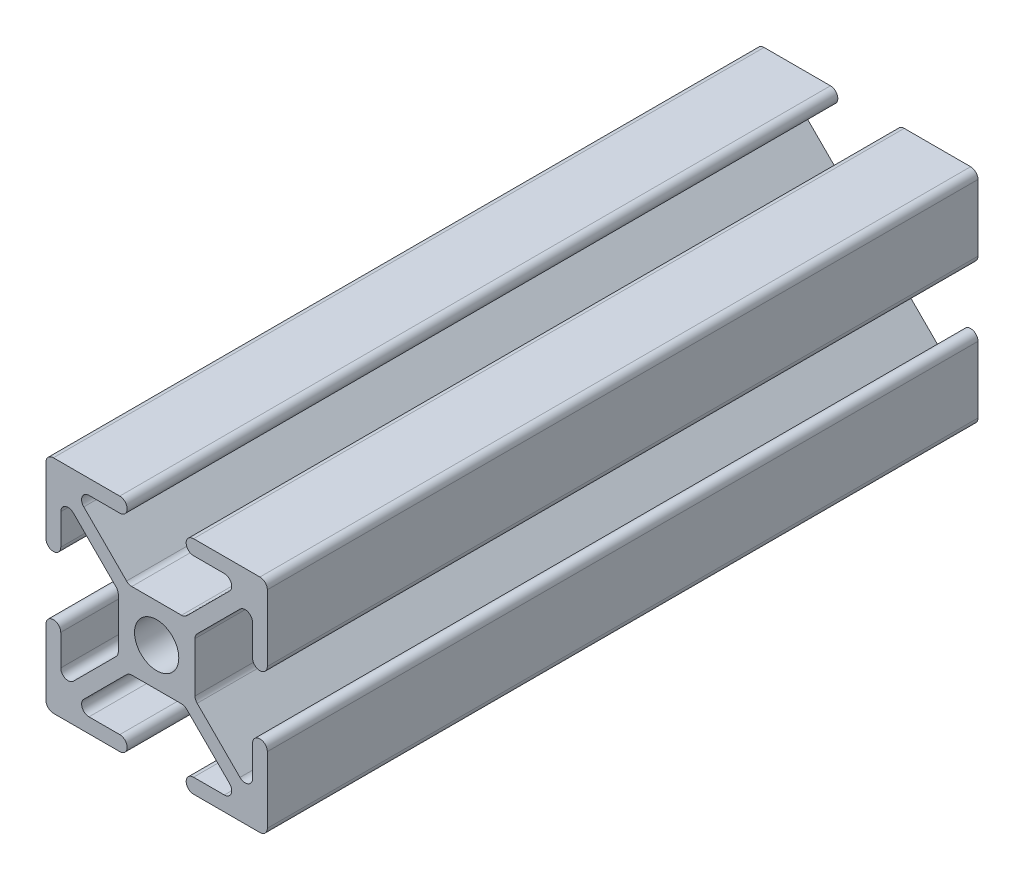
from build123d import *

# Parameters (mm, degrees)
SALIENTE_EXTRUIR1_DEPTH = 96.34
CROQUIS2_R              = 3
CORTAR_EXTRUIR1_DEPTH   = 99.647836266
CORTAR_EXTRUIR3_DEPTH   = 99.647836266


with BuildPart() as part:
    # Croquis1 → Saliente-Extruir1 (new body)
    with BuildSketch(Plane.XY):
        with BuildLine():
            Line((-14, 15), (14, 15))
            ThreePointArc((14, 15), (14.707106781, 14.707106781), (15, 14))
            Line((15, 14), (15, -14))
            ThreePointArc((15, -14), (14.707106781, -14.707106781), (14, -15))
            Line((14, -15), (-14, -15))
            ThreePointArc((-14, -15), (-14.707106781, -14.707106781), (-15, -14))
            Line((-15, -14), (-15, 14))
            ThreePointArc((-15, 14), (-14.707106781, 14.707106781), (-14, 15))
        make_face()
    extrude(amount=-SALIENTE_EXTRUIR1_DEPTH)

    # Croquis2 → Cortar-Extruir1 (cut, through all)
    with BuildSketch(Plane.XY):
        Circle(CROQUIS2_R)
    extrude(amount=-CORTAR_EXTRUIR1_DEPTH, mode=Mode.SUBTRACT)

    # Croquis3 → Cortar-Extruir3 (cut, through all)
    with BuildSketch(Plane.XY):
        with BuildLine():
            Line((-5.492893219, 4.078679656), (-11.292893219, 9.878679656))
            ThreePointArc((-11.292893219, 9.878679656), (-12.382683432, 10.095452408), (-13, 9.171572875))
            Line((-13, 9.171572875), (-13, 5))
            ThreePointArc((-13, 5), (-14, 4), (-15, 5))
            Line((-15, 5), (-15, -5))
            ThreePointArc((-15, -5), (-14, -4), (-13, -5))
            Line((-13, -5), (-13, -9.171572875))
            ThreePointArc((-13, -9.171572875), (-12.382683432, -10.095452408), (-11.292893219, -9.878679656))
            Line((-11.292893219, -9.878679656), (-5.492893219, -4.078679656))
            ThreePointArc((-5.492893219, -4.078679656), (-5.276120467, -3.754256308), (-5.2, -3.371572875))
            Line((-5.2, -3.371572875), (-5.2, 3.371572875))
            ThreePointArc((-5.2, 3.371572875), (-5.276120467, 3.754256308), (-5.492893219, 4.078679656))
        make_face()
        with BuildLine():
            ThreePointArc((-9.171572875, 13), (-10.095452408, 12.382683432), (-9.878679656, 11.292893219))
            Line((-9.878679656, 11.292893219), (-4.078679656, 5.492893219))
            ThreePointArc((-4.078679656, 5.492893219), (-3.754256308, 5.276120467), (-3.371572875, 5.2))
            Line((-3.371572875, 5.2), (3.371572875, 5.2))
            ThreePointArc((3.371572875, 5.2), (3.754256308, 5.276120467), (4.078679656, 5.492893219))
            Line((4.078679656, 5.492893219), (9.878679656, 11.292893219))
            ThreePointArc((9.878679656, 11.292893219), (10.095452408, 12.382683432), (9.171572875, 13))
            Line((9.171572875, 13), (5, 13))
            ThreePointArc((5, 13), (4, 14), (5, 15))
            Line((5, 15), (-5, 15))
            ThreePointArc((-5, 15), (-4.292893219, 14.707106781), (-4, 14))
            ThreePointArc((-4, 14), (-4.292893219, 13.292893219), (-5, 13))
            Line((-5, 13), (-9.171572875, 13))
        make_face()
        with BuildLine():
            Line((9.878679656, -11.292893219), (4.078679656, -5.492893219))
            ThreePointArc((4.078679656, -5.492893219), (3.754256308, -5.276120467), (3.371572875, -5.2))
            Line((3.371572875, -5.2), (-3.371572875, -5.2))
            ThreePointArc((-3.371572875, -5.2), (-3.754256308, -5.276120467), (-4.078679656, -5.492893219))
            Line((-4.078679656, -5.492893219), (-9.878679656, -11.292893219))
            ThreePointArc((-9.878679656, -11.292893219), (-10.095452408, -12.382683432), (-9.171572875, -13))
            Line((-9.171572875, -13), (-5, -13))
            ThreePointArc((-5, -13), (-4.292893219, -13.292893219), (-4, -14))
            ThreePointArc((-4, -14), (-4.292893219, -14.707106781), (-5, -15))
            Line((-5, -15), (5, -15))
            ThreePointArc((5, -15), (4, -14), (5, -13))
            Line((5, -13), (9.171572875, -13))
            ThreePointArc((9.171572875, -13), (10.095452408, -12.382683432), (9.878679656, -11.292893219))
        make_face()
        with BuildLine():
            ThreePointArc((13, 9.171572875), (12.382683432, 10.095452408), (11.292893219, 9.878679656))
            Line((11.292893219, 9.878679656), (5.492893219, 4.078679656))
            ThreePointArc((5.492893219, 4.078679656), (5.276120467, 3.754256308), (5.2, 3.371572875))
            Line((5.2, 3.371572875), (5.2, -3.371572875))
            ThreePointArc((5.2, -3.371572875), (5.276120467, -3.754256308), (5.492893219, -4.078679656))
            Line((5.492893219, -4.078679656), (11.292893219, -9.878679656))
            ThreePointArc((11.292893219, -9.878679656), (12.382683432, -10.095452408), (13, -9.171572875))
            Line((13, -9.171572875), (13, -5))
            ThreePointArc((13, -5), (14, -4), (15, -5))
            Line((15, -5), (15, 5))
            ThreePointArc((15, 5), (14, 4), (13, 5))
            Line((13, 5), (13, 9.171572875))
        make_face()
    extrude(amount=-CORTAR_EXTRUIR3_DEPTH, mode=Mode.SUBTRACT)


solid = part.part
